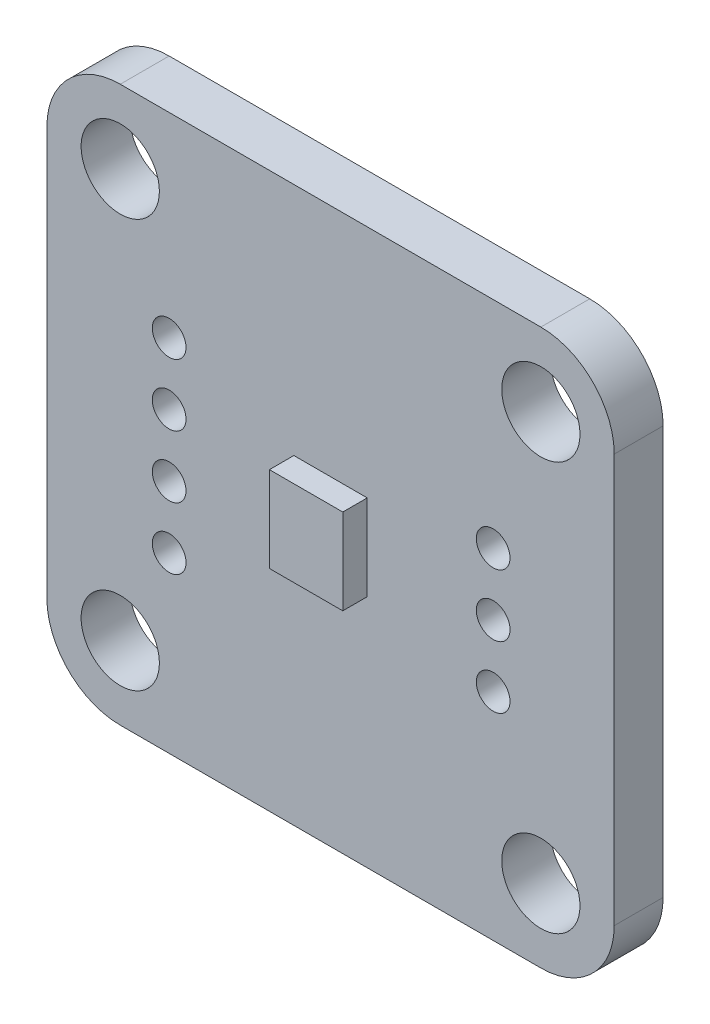
from build123d import *

# Parameters (mm, degrees)
ESBO_O2_R                = 1.6
RESSALTO_EXTRUS_O1_DEPTH = 2
ESBO_O3_R                = 0.69
CORTE_EXTRUS_O1_DEPTH    = 2
ESBO_O4_W                = 3
ESBO_O4_H                = 3.5
RESSALTO_EXTRUS_O2_DEPTH = 1


with BuildPart() as part:
    # Esboço2 → Ressalto-extrusão1 (new body)
    with BuildSketch(Plane.XY):
        with BuildLine():
            Line((8.6, -11.35), (-8.6, -11.35))
            ThreePointArc((-8.6, -11.35), (-10.721320344, -10.471320344), (-11.6, -8.35))
            Line((-11.6, -8.35), (-11.6, 8.35))
            ThreePointArc((-11.6, 8.35), (-10.721320344, 10.471320344), (-8.6, 11.35))
            Line((-8.6, 11.35), (8.6, 11.35))
            ThreePointArc((8.6, 11.35), (10.721320344, 10.471320344), (11.6, 8.35))
            Line((11.6, 8.35), (11.6, -8.35))
            ThreePointArc((11.6, -8.35), (10.721320344, -10.471320344), (8.6, -11.35))
        make_face()
        with Locations((-8.6, -8.35)):
            Circle(ESBO_O2_R, mode=Mode.SUBTRACT)
        with Locations((-8.6, 8.35)):
            Circle(ESBO_O2_R, mode=Mode.SUBTRACT)
        with Locations((8.6, 8.35)):
            Circle(ESBO_O2_R, mode=Mode.SUBTRACT)
        with Locations((8.6, -8.35)):
            Circle(ESBO_O2_R, mode=Mode.SUBTRACT)
    extrude(amount=RESSALTO_EXTRUS_O1_DEPTH)

    # Esboço3 → Corte-extrusão1 (cut)
    with BuildSketch(Plane.XY.offset(2)):
        with Locations((-6.6, -4.25)):
            Circle(ESBO_O3_R)
        with Locations((-6.6, -1.71)):
            Circle(ESBO_O3_R)
        with Locations((-6.6, 0.83)):
            Circle(ESBO_O3_R)
        with Locations((-6.6, 3.37)):
            Circle(ESBO_O3_R)
        with Locations((6.65, 0)):
            Circle(ESBO_O3_R)
        with Locations((6.65, 2.54)):
            Circle(ESBO_O3_R)
        with Locations((6.65, -2.54)):
            Circle(ESBO_O3_R)
    extrude(amount=-CORTE_EXTRUS_O1_DEPTH, mode=Mode.SUBTRACT)

    # Esboço4 → Ressalto-extrusão2 (add)
    with BuildSketch(Plane.XY.offset(2)):
        Rectangle(ESBO_O4_W, ESBO_O4_H)
    extrude(amount=RESSALTO_EXTRUS_O2_DEPTH)


solid = part.part
